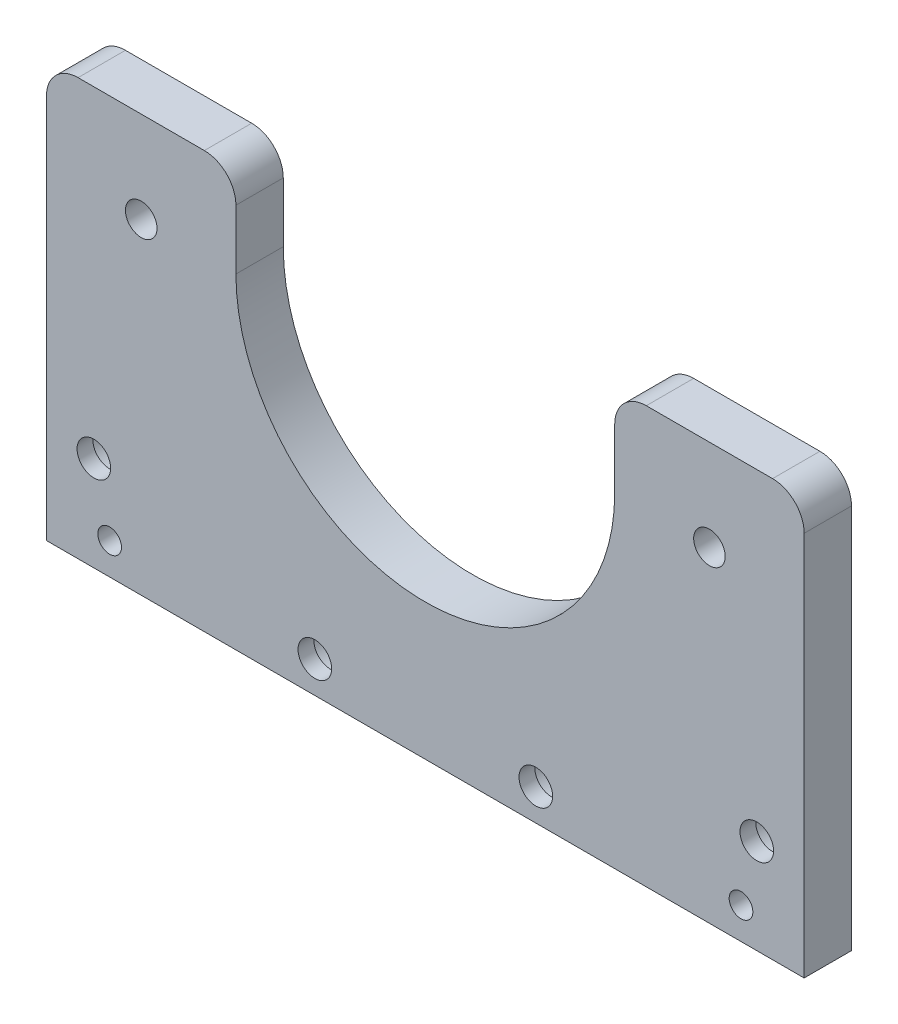
from build123d import *

# Parameters (mm, degrees)
SKETCH1_R                                   = 3.175
BASE_DEPTH                                  = 4.7625
F_1_4_CAP_SCREW_CARRIAGE_MOUNTS_D           = 6.7564
F_1_4_CAP_SCREW_CARRIAGE_MOUNTS_CBORE_D     = 11.1125
F_1_4_CAP_SCREW_CARRIAGE_MOUNTS_CBORE_DEPTH = 6.35
SKETCH9_R                                   = 2.38125
ALIGNMENT_PIN_HOLES_DEPTH                   = 6.35


with BuildPart() as part:
    # Sketch1 → Base (new, symmetric)
    with BuildSketch(Plane.XY):
        with BuildLine():
            Line((76.2, 11.98626), (76.2, -65.48374))
            Line((76.2, -65.48374), (-76.2, -65.48374))
            Line((-76.2, -65.48374), (-76.2, 11.98626))
            ThreePointArc((-76.2, 11.98626), (-74.340128061, 16.476388061), (-69.85, 18.33626))
            Line((-69.85, 18.33626), (-44.45, 18.33626))
            ThreePointArc((-44.45, 18.33626), (-39.959871939, 16.476388061), (-38.1, 11.98626))
            Line((-38.1, 11.98626), (-38.1, 0))
            ThreePointArc((-38.1, 0), (0, -38.1), (38.1, 0))
            Line((38.1, 0), (38.1, 11.98626))
            ThreePointArc((38.1, 11.98626), (39.959871939, 16.476388061), (44.45, 18.33626))
            Line((44.45, 18.33626), (69.85, 18.33626))
            ThreePointArc((69.85, 18.33626), (74.340128061, 16.476388061), (76.2, 11.98626))
        make_face()
        with Locations((-57.15, 0)):
            Circle(SKETCH1_R, mode=Mode.SUBTRACT)
        with Locations((57.15, 0)):
            Circle(SKETCH1_R, mode=Mode.SUBTRACT)
    extrude(amount=BASE_DEPTH, both=True)

    # 1/4 Cap screw carriage mounts (through all)
    with Locations(Plane(origin=(-61.987391614, 5.409091563, -4.7625), x_dir=(1, 0, 0), z_dir=(0, 0, -1))):
        with Locations((-4.687608386, 51.842831563), (39.762391614, 64.542831563), (128.662391614, 51.842831563), (84.212391614, 64.542831563)):
            CounterBoreHole(F_1_4_CAP_SCREW_CARRIAGE_MOUNTS_D / 2, F_1_4_CAP_SCREW_CARRIAGE_MOUNTS_CBORE_D / 2, F_1_4_CAP_SCREW_CARRIAGE_MOUNTS_CBORE_DEPTH)

    # Sketch9 → Alignment_pin_holes (cut)
    with BuildSketch(Plane(origin=(0, 0, 4.7625), x_dir=(-1, 0, 0), z_dir=(0, 0, -1))):
        with Locations((63.5, -59.13374)):
            Circle(SKETCH9_R)
        with Locations((-63.5, -59.13374)):
            Circle(SKETCH9_R)
    extrude(amount=ALIGNMENT_PIN_HOLES_DEPTH, mode=Mode.SUBTRACT)


solid = part.part
